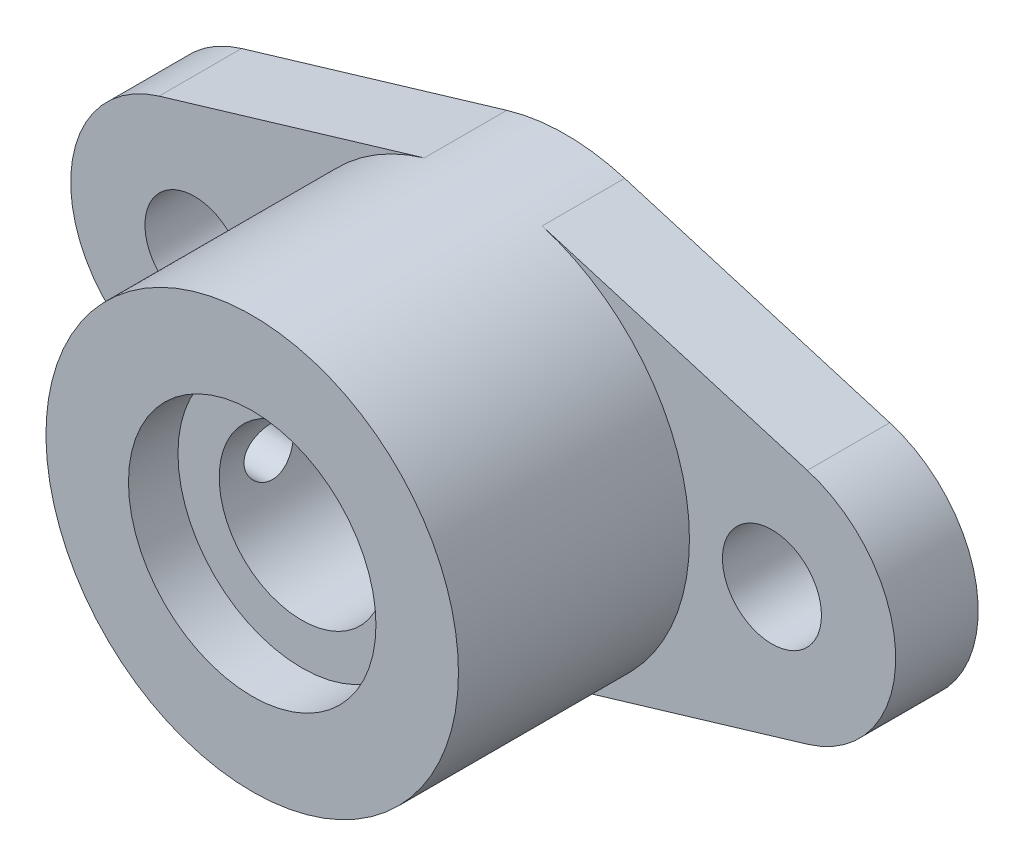
from build123d import *

# Parameters (mm, degrees)
SKETCH1_R                                 = 6
BOSS_EXTRUDE1_DEPTH                       = 10
BOSS_EXTRUDE1_2_DEPTH                     = 10
BOSS_EXTRUDE2_DEPTH                       = 38
CBORE_FOR_M12_HEX_HEAD_SCREW1_D           = 20
CBORE_FOR_M12_HEX_HEAD_SCREW1_CBORE_D     = 30
CBORE_FOR_M12_HEX_HEAD_SCREW1_CBORE_DEPTH = 6
SKETCH6_R                                 = 3
CUT_EXTRUDE1_DEPTH                        = 38


with BuildPart() as part:
    # Sketch1 → Boss-Extrude1 (new body)
    with BuildSketch(Plane.XY):
        with BuildLine():
            Line((-7.142857143, 23.957871187), (-39.285714286, 14.374722712))
            ThreePointArc((-39.285714286, 14.374722712), (-50, 0), (-39.285714286, -14.374722712))
            Line((-39.285714286, -14.374722712), (-7.142857143, -23.957871187))
            ThreePointArc((-7.142857143, -23.957871187), (-25, 0), (-7.142857143, 23.957871187))
        make_face()
        with Locations((-35, 0)):
            Circle(SKETCH1_R, mode=Mode.SUBTRACT)
    extrude(amount=BOSS_EXTRUDE1_DEPTH)



with BuildPart() as body_2:
    # Sketch1 → Boss-Extrude1 2 (new body)
    with BuildSketch(Plane.XY):
        with BuildLine():
            Line((39.285714286, 14.374722712), (7.142857143, 23.957871187))
            ThreePointArc((7.142857143, 23.957871187), (25, 0), (7.142857143, -23.957871187))
            Line((7.142857143, -23.957871187), (39.285714286, -14.374722712))
            ThreePointArc((39.285714286, -14.374722712), (50, 0), (39.285714286, 14.374722712))
        make_face()
        with Locations((35, 0)):
            Circle(SKETCH1_R, mode=Mode.SUBTRACT)
    extrude(amount=BOSS_EXTRUDE1_2_DEPTH)


with BuildPart() as part_1:
    add(part.part)

    add(body_2.part)  # Boss-Extrude2 merges body 2
    # Sketch1<3> → Boss-Extrude2 (add)
    with BuildSketch(Plane.XY):
        with BuildLine():
            ThreePointArc((7.142857143, 23.957871187), (0, 25), (-7.142857143, 23.957871187))
            ThreePointArc((-7.142857143, 23.957871187), (-25, 0), (-7.142857143, -23.957871187))
            ThreePointArc((-7.142857143, -23.957871187), (0, -25), (7.142857143, -23.957871187))
            ThreePointArc((7.142857143, -23.957871187), (20.044593143, -14.940357617), (25, 0))
            ThreePointArc((25, 0), (20.044593143, 14.940357617), (7.142857143, 23.957871187))
        make_face()
    extrude(amount=BOSS_EXTRUDE2_DEPTH)

    # CBORE for M12 Hex Head Screw1 (through all)
    with Locations(Plane.XY.offset(38)):
        with Locations((0, 0)):
            CounterBoreHole(CBORE_FOR_M12_HEX_HEAD_SCREW1_D / 2, CBORE_FOR_M12_HEX_HEAD_SCREW1_CBORE_D / 2, CBORE_FOR_M12_HEX_HEAD_SCREW1_CBORE_DEPTH)

    # Sketch6 → Cut-Extrude1 (cut)
    with BuildSketch(Plane(origin=(0, 0, 0), x_dir=(0, 0, -1), z_dir=(1, 0, 0))):
        with Locations((-26, 0)):
            Circle(SKETCH6_R)
    extrude(amount=-CUT_EXTRUDE1_DEPTH, mode=Mode.SUBTRACT)


solid = part_1.part
